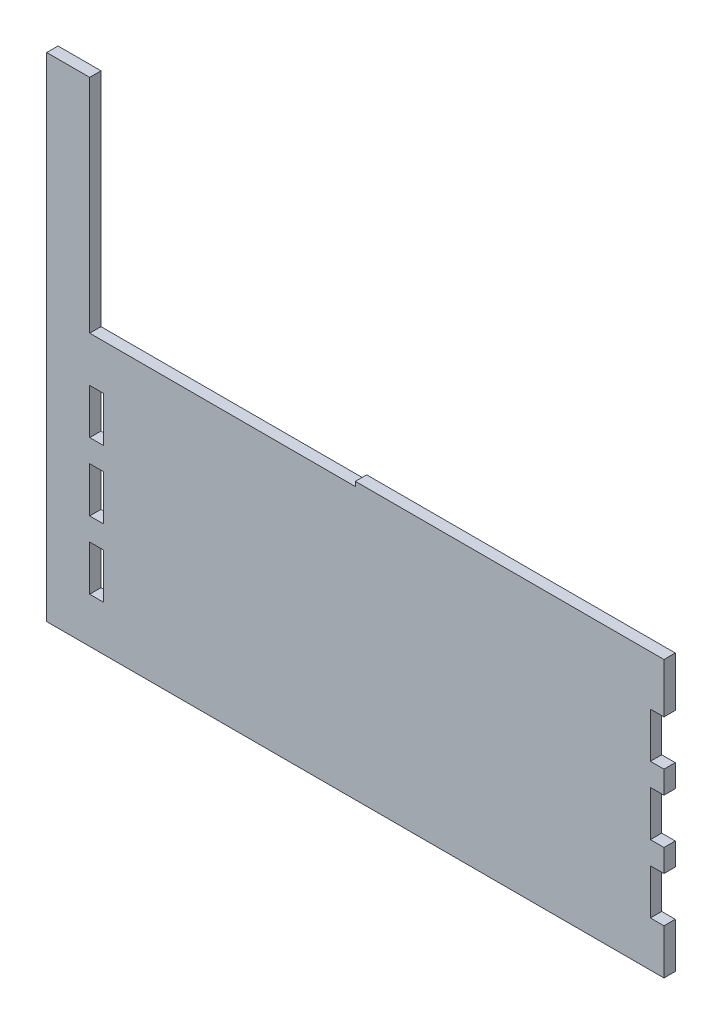
from build123d import *

# Parameters (mm, degrees)
SKETCH1_W           = 273
SKETCH1_H           = 122
BOSS_EXTRUDE1_DEPTH = 5
SKETCH2_W           = 19
SKETCH2_H           = 96
BOSS_EXTRUDE2_DEPTH = 5
SKETCH3_W           = 6
SKETCH3_H           = 20
CUT_EXTRUDE1_DEPTH  = 6
SKETCH6_W           = 117.5
SKETCH6_H           = 2
CUT_EXTRUDE3_DEPTH  = 6


with BuildPart() as part:
    # Sketch1 → Boss-Extrude1 (new body)
    with BuildSketch(Plane.XY):
        Rectangle(SKETCH1_W, SKETCH1_H)
    extrude(amount=BOSS_EXTRUDE1_DEPTH)

    # Sketch2 → Boss-Extrude2 (add)
    with BuildSketch(Plane.XY.offset(5)):
        with Locations((-127, 109)):
            Rectangle(SKETCH2_W, SKETCH2_H)
    extrude(amount=-BOSS_EXTRUDE2_DEPTH)

    # Sketch3 → Cut-Extrude1 (cut)
    with BuildSketch(Plane.XY.offset(5)):
        with Locations((-114.5, 29)):
            Rectangle(SKETCH3_W, SKETCH3_H)
        with Locations((-114.5, -1)):
            Rectangle(SKETCH3_W, SKETCH3_H)
        with Locations((-114.5, -31)):
            Rectangle(SKETCH3_W, SKETCH3_H)
        with Locations((133.5, 29)):
            Rectangle(SKETCH3_W, SKETCH3_H)
        with Locations((133.5, -1)):
            Rectangle(SKETCH3_W, SKETCH3_H)
        with Locations((133.5, -31)):
            Rectangle(SKETCH3_W, SKETCH3_H)
    extrude(amount=-CUT_EXTRUDE1_DEPTH, mode=Mode.SUBTRACT)

    # Sketch6 → Cut-Extrude3 (cut)
    with BuildSketch(Plane.XY.offset(5)):
        with Locations((-58.75, 60)):
            Rectangle(SKETCH6_W, SKETCH6_H)
    extrude(amount=-CUT_EXTRUDE3_DEPTH, mode=Mode.SUBTRACT)


solid = part.part
